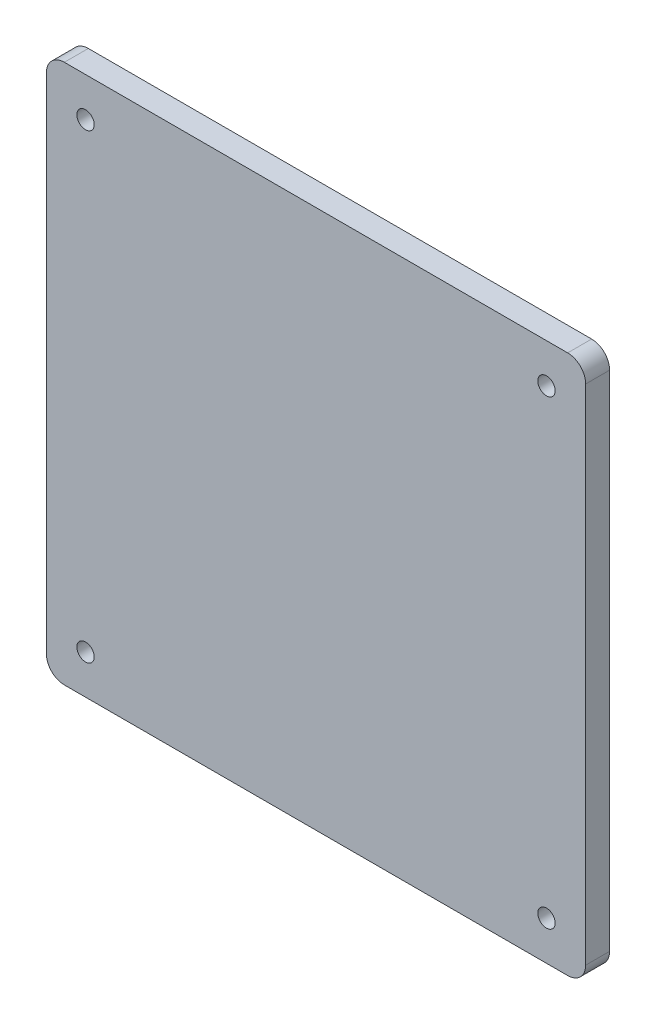
from build123d import *

# Parameters (mm, degrees)
SKETCH1_R           = 1.45
BOSS_EXTRUDE1_DEPTH = 4


with BuildPart() as part:
    # Sketch1 → Boss-Extrude1 (new body)
    with BuildSketch(Plane.XY):
        with BuildLine():
            Line((42, 45), (-42, 45))
            ThreePointArc((-42, 45), (-44.121320344, 44.121320344), (-45, 42))
            Line((-45, 42), (-45, -42))
            ThreePointArc((-45, -42), (-44.121320344, -44.121320344), (-42, -45))
            Line((-42, -45), (42, -45))
            ThreePointArc((42, -45), (44.121320344, -44.121320344), (45, -42))
            Line((45, -42), (45, 42))
            ThreePointArc((45, 42), (44.121320344, 44.121320344), (42, 45))
        make_face()
        with Locations((-38.464466094, -38.464466094)):
            Circle(SKETCH1_R, mode=Mode.SUBTRACT)
        with Locations((38.464466094, -38.464466094)):
            Circle(SKETCH1_R, mode=Mode.SUBTRACT)
        with Locations((38.464466094, 38.464466094)):
            Circle(SKETCH1_R, mode=Mode.SUBTRACT)
        with Locations((-38.464466094, 38.464466094)):
            Circle(SKETCH1_R, mode=Mode.SUBTRACT)
    extrude(amount=BOSS_EXTRUDE1_DEPTH)


solid = part.part
